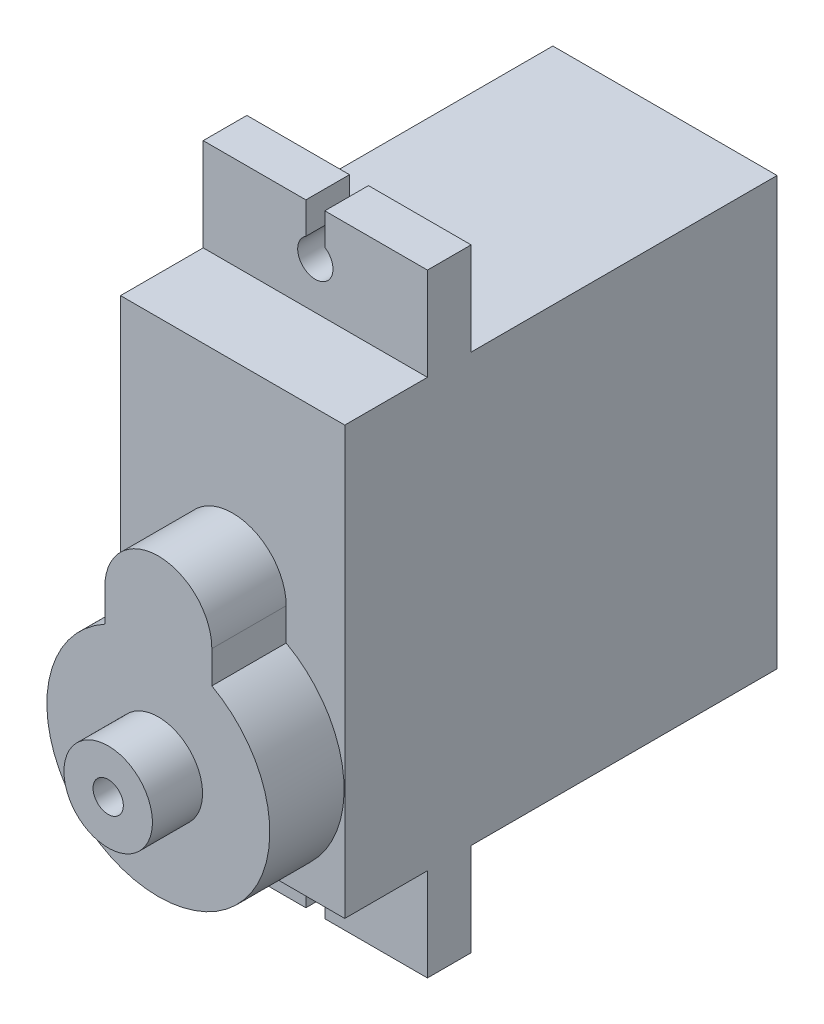
from build123d import *

# Parameters (mm, degrees)
SKETCH1_W           = 12.07
SKETCH1_H           = 23.27
BOSS_EXTRUDE1_DEPTH = 23
SKETCH2_R           = 6
BOSS_EXTRUDE3_DEPTH = 4
BOSS_EXTRUDE4_DEPTH = 4
SKETCH6_W           = 12.07
SKETCH6_H           = 2.35
BOSS_EXTRUDE5_DEPTH = 5
SKETCH7_W           = 12.07
SKETCH7_H           = 2.35
BOSS_EXTRUDE6_DEPTH = 5
SKETCH8_R           = 0.95
CUT_EXTRUDE1_DEPTH  = 36.831233582
SKETCH9_W           = 1.02
SKETCH9_H           = 2.5
CUT_EXTRUDE2_DEPTH  = 36.831233582
SKETCH10_R          = 2.38
SKETCH10_R_2        = 0.815
BOSS_EXTRUDE7_DEPTH = 2.7


with BuildPart() as part:
    # Sketch1 → Boss-Extrude1 (new body)
    with BuildSketch(Plane(origin=(0, 0, 0), x_dir=(1, 0, 0), z_dir=(0, 1, 0))):
        with Locations((6.035, 11.635)):
            Rectangle(SKETCH1_W, SKETCH1_H)
    extrude(amount=BOSS_EXTRUDE1_DEPTH)

    # Sketch2 → Boss-Extrude3 (add)
    with BuildSketch(Plane.XY):
        with Locations(Location((6.035, 6, 0), (0, 0, 270))):
            Circle(SKETCH2_R)
    extrude(amount=BOSS_EXTRUDE3_DEPTH)

    # Sketch4 → Boss-Extrude4 (add)
    with BuildSketch(Plane.XY):
        with BuildLine():
            Line((3.155, 13), (3.155, 11.263610928))
            Line((3.155, 11.263610928), (8.915, 11.263610928))
            Line((8.915, 11.263610928), (8.915, 13))
            ThreePointArc((8.915, 13), (6.035, 15.88), (3.155, 13))
        make_face()
    extrude(amount=BOSS_EXTRUDE4_DEPTH)

    # Sketch6 → Boss-Extrude5 (add)
    with BuildSketch(Plane.XZ):
        with Locations((6.035, -5.625)):
            Rectangle(SKETCH6_W, SKETCH6_H)
    extrude(amount=BOSS_EXTRUDE5_DEPTH)

    # Sketch7 → Boss-Extrude6 (add)
    with BuildSketch(Plane(origin=(0, 23, 0), x_dir=(-1, 0, 0), z_dir=(0, 1, 0))):
        with Locations((-6.035, -5.625)):
            Rectangle(SKETCH7_W, SKETCH7_H)
    extrude(amount=BOSS_EXTRUDE6_DEPTH)

    # Sketch8 → Cut-Extrude1 (cut, through all)
    with BuildSketch(Plane.XY.offset(-4.45)):
        with Locations((6.035, 25.5)):
            Circle(SKETCH8_R)
        with Locations((6.035, -2.5)):
            Circle(SKETCH8_R)
    extrude(amount=-CUT_EXTRUDE1_DEPTH, mode=Mode.SUBTRACT)

    # Sketch9 → Cut-Extrude2 (cut, through all)
    with BuildSketch(Plane.XY.offset(-4.45)):
        with Locations((6.035, 26.75)):
            Rectangle(SKETCH9_W, SKETCH9_H)
        with Locations((6.035, -3.75)):
            Rectangle(SKETCH9_W, SKETCH9_H)
    extrude(amount=-CUT_EXTRUDE2_DEPTH, mode=Mode.SUBTRACT)

    # Sketch10 → Boss-Extrude7 (add)
    with BuildSketch(Plane.XY.offset(4)):
        with Locations(Location((6.035, 6, 0), (0, 0, 180))):
            Circle(SKETCH10_R)
        with Locations(Location((6.035, 6, 0), (0, 0, 180))):
            Circle(SKETCH10_R_2, mode=Mode.SUBTRACT)
    extrude(amount=BOSS_EXTRUDE7_DEPTH)


solid = part.part
